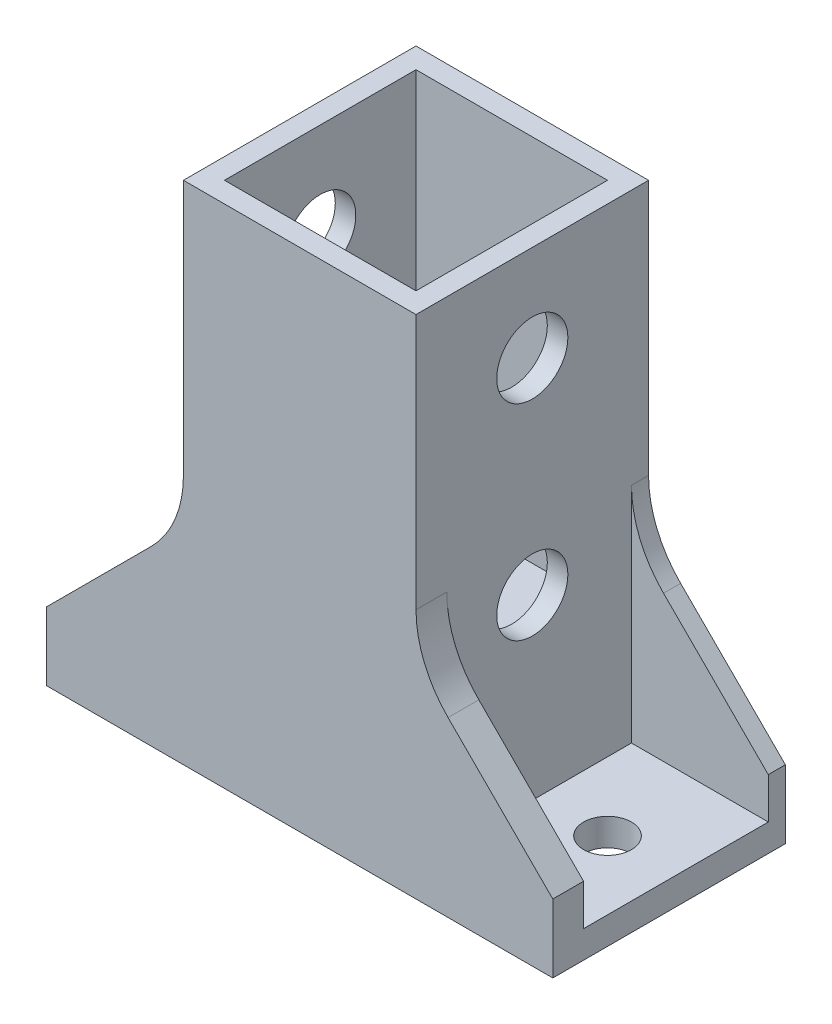
from build123d import *

# Parameters (mm, degrees)
BASE_SHAPE_DEPTH      = 17
SKETCH2_W             = 14
SKETCH2_H             = 14
CENTER_SLOT_DEPTH     = 27
SKETCH4_W             = 10
SKETCH4_H             = 13.5
WING_CUT_OUTS_DEPTH   = 16.5
SKETCH5_R             = 1.75
WING_HOLES_DEPTH      = 48.360320945
WIRE_SLOT_REACH       = 50.857
SKETCH6_W             = 5
SKETCH6_H             = 2
LOAD_CELL_HOLES_REACH = 50.857
SKETCH7_R             = 2.6


with BuildPart() as part:
    # Sketch1 → Base Shape (new body)
    with BuildSketch(Plane.XY):
        with BuildLine():
            Line((0, 18.313708499), (0, 37))
            Line((0, 37), (17, 37))
            Line((17, 37), (17, 18.313708499))
            ThreePointArc((17, 18.313708499), (17.60896374, 15.25224104), (19.343145751, 12.656854249))
            Line((19.343145751, 12.656854249), (27, 5))
            Line((27, 5), (27, 0))
            Line((27, 0), (17, 0))
            Line((17, 0), (0, 0))
            Line((0, 0), (-10, 0))
            Line((-10, 0), (-10, 5))
            Line((-10, 5), (-2.343145751, 12.656854249))
            ThreePointArc((-2.343145751, 12.656854249), (-0.60896374, 15.25224104), (0, 18.313708499))
        make_face()
    extrude(amount=BASE_SHAPE_DEPTH)

    # Sketch2 → Center Slot (cut)
    with BuildSketch(Plane(origin=(0, 37, 0), x_dir=(1, 0, 0), z_dir=(0, 1, 0))):
        with Locations((8.5, -8.5)):
            Rectangle(SKETCH2_W, SKETCH2_H)
    extrude(amount=-CENTER_SLOT_DEPTH, mode=Mode.SUBTRACT)

    # Sketch4 → Wing Cut Outs (cut)
    with BuildSketch(Plane(origin=(0, 2, 0), x_dir=(-1, 0, 0), z_dir=(0, -1, 0))):
        with Locations((5, -8)):
            Rectangle(SKETCH4_W, SKETCH4_H)
    wing_cut_outs = extrude(amount=-WING_CUT_OUTS_DEPTH, mode=Mode.SUBTRACT)

    # Mirror1: Wing Cut Outs across plane
    add(wing_cut_outs.mirror(Plane(origin=(8.5, 0, 0), x_dir=(0, 0, 1), z_dir=(1, 0, 0))), mode=Mode.SUBTRACT)

    # Sketch5 → Wing Holes (cut, through all)
    with BuildSketch(Plane(origin=(0, 2, 0), x_dir=(-1, 0, 0), z_dir=(0, -1, 0))):
        with Locations(Location((5, -8, 0), (0, 0, 180))):
            Circle(SKETCH5_R)
    wing_holes = extrude(amount=WING_HOLES_DEPTH, mode=Mode.SUBTRACT)

    # Mirror2: Wing Holes across plane
    add(wing_holes.mirror(Plane(origin=(8.5, 0, 0), x_dir=(0, 0, 1), z_dir=(1, 0, 0))), mode=Mode.SUBTRACT)

    # Sketch6 → Wire Slot (cut, up to next)
    with BuildSketch(Plane.XY, mode=Mode.PRIVATE) as wire_slot_sk1:
        with Locations((8, 15)):
            Rectangle(SKETCH6_W, SKETCH6_H)
    wire_slot_tool1 = extrude(wire_slot_sk1.sketch, amount=WIRE_SLOT_REACH, mode=Mode.PRIVATE) & part.part
    add(wire_slot_tool1.solids().sort_by_distance((8, 15, 0))[0], mode=Mode.SUBTRACT)

    # Sketch7 → Load Cell Holes (cut, up to next)
    with BuildSketch(Plane(origin=(0, 0, 0), x_dir=(0, 0, -1), z_dir=(1, 0, 0)), mode=Mode.PRIVATE) as load_cell_holes_sk1:
        with Locations(Location((-8.5, 15, 0), (0, 0, 180))):
            Circle(SKETCH7_R)
    load_cell_holes_tool1 = extrude(load_cell_holes_sk1.sketch, amount=LOAD_CELL_HOLES_REACH, mode=Mode.PRIVATE) & part.part
    # Sketch7 → Load Cell Holes (cut, up to next)
    with BuildSketch(Plane(origin=(0, 0, 0), x_dir=(0, 0, -1), z_dir=(1, 0, 0)), mode=Mode.PRIVATE) as load_cell_holes_sk2:
        with Locations(Location((-8.5, 30, 0), (0, 0, 180))):
            Circle(SKETCH7_R)
    load_cell_holes_tool2 = extrude(load_cell_holes_sk2.sketch, amount=LOAD_CELL_HOLES_REACH, mode=Mode.PRIVATE) & part.part
    load_cell_holes_1 = load_cell_holes_tool1.solids().sort_by_distance((0, 15, 8.5))[0]
    add(load_cell_holes_1, mode=Mode.SUBTRACT)
    load_cell_holes_2 = load_cell_holes_tool2.solids().sort_by_distance((0, 30, 8.5))[0]
    add(load_cell_holes_2, mode=Mode.SUBTRACT)
    load_cell_holes = load_cell_holes_1 + load_cell_holes_2  # Load Cell Holes as one shape, for the pattern or mirror that repeats it

    # Mirror3: Load Cell Holes across plane
    add(load_cell_holes.mirror(Plane(origin=(8.5, 0, 0), x_dir=(0, 0, 1), z_dir=(1, 0, 0))), mode=Mode.SUBTRACT)


solid = part.part
